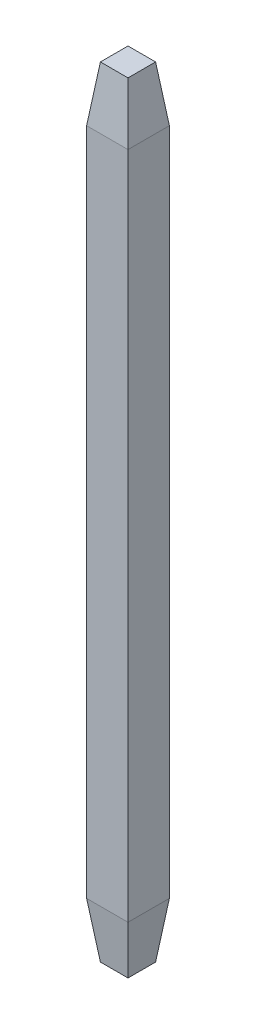
from build123d import *
from OCP.BRepFilletAPI import BRepFilletAPI_MakeChamfer

# Parameters (mm, degrees)
SKETCH_1_W      = 0.6
SKETCH_1_H      = 0.6
EXTRUDE_1_DEPTH = 11.3
CHAMFER_1_SIZE  = 0.8
CHAMFER_1_SIZE2 = 0.1


with BuildPart() as part:
    # 스케치1 → 보스-돌출1 (new body)
    with BuildSketch(Plane(origin=(0, 0, 0), x_dir=(1, 0, 0), z_dir=(0, 1, 0))):
        Rectangle(SKETCH_1_W, SKETCH_1_H)
    extrude(amount=EXTRUDE_1_DEPTH)

    # 모따기1: one chamfer whose edges measure the first distance from different faces: ONE call of the kernel's chamfer builder (chamfer() names one face for all edges)
    chamfer_1_edges_1 = [part.edges().sort_by_distance(p)[0] for p in [
        (0, 0, -0.3),
        (0, 11.3, -0.3),
    ]]
    chamfer_1_side_1 = [part.faces().sort_by_distance(p)[0] for p in [
        (0, 5.65, -0.3),
    ]]
    chamfer_1_edges_2 = [part.edges().sort_by_distance(p)[0] for p in [
        (-0.3, 0, 0),
        (-0.3, 11.3, 0),
    ]]
    chamfer_1_side_2 = [part.faces().sort_by_distance(p)[0] for p in [
        (-0.3, 5.65, 0),
    ]]
    chamfer_1_edges_3 = [part.edges().sort_by_distance(p)[0] for p in [
        (0, 0, 0.3),
        (0, 11.3, 0.3),
    ]]
    chamfer_1_side_3 = [part.faces().sort_by_distance(p)[0] for p in [
        (0, 5.65, 0.3),
    ]]
    chamfer_1_edges_4 = [part.edges().sort_by_distance(p)[0] for p in [
        (0.3, 0, 0),
        (0.3, 11.3, 0),
    ]]
    chamfer_1_side_4 = [part.faces().sort_by_distance(p)[0] for p in [
        (0.3, 5.65, 0),
    ]]
    chamfer_1 = BRepFilletAPI_MakeChamfer(part.part.solid().wrapped)
    for e in chamfer_1_edges_1:
        chamfer_1.Add(CHAMFER_1_SIZE, CHAMFER_1_SIZE2, e.wrapped, chamfer_1_side_1[0].wrapped)  # the first distance lies on this face
    for e in chamfer_1_edges_2:
        chamfer_1.Add(CHAMFER_1_SIZE, CHAMFER_1_SIZE2, e.wrapped, chamfer_1_side_2[0].wrapped)  # the first distance lies on this face
    for e in chamfer_1_edges_3:
        chamfer_1.Add(CHAMFER_1_SIZE, CHAMFER_1_SIZE2, e.wrapped, chamfer_1_side_3[0].wrapped)  # the first distance lies on this face
    for e in chamfer_1_edges_4:
        chamfer_1.Add(CHAMFER_1_SIZE, CHAMFER_1_SIZE2, e.wrapped, chamfer_1_side_4[0].wrapped)  # the first distance lies on this face
    add(Compound.cast(chamfer_1.Shape()), mode=Mode.REPLACE)


solid = part.part
